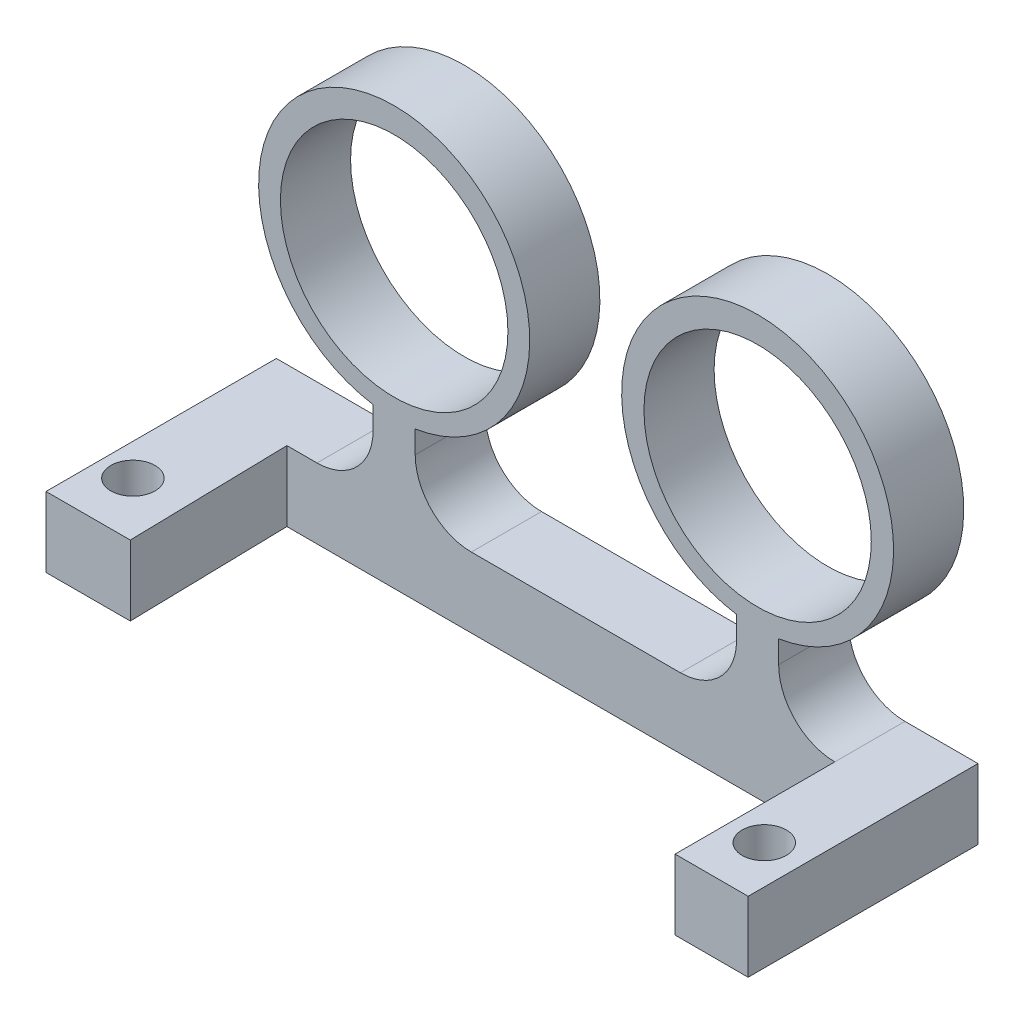
from build123d import *

# Parameters (mm, degrees)
SKETCH1_R           = 8.106403635
SKETCH1_R_2         = 8.1
BOSS_EXTRUDE2_DEPTH = 5
FILLET1_R           = 4
SKETCH3_W           = 5.205268412
SKETCH3_H           = 16.38085221
BOSS_EXTRUDE3_DEPTH = 5
SKETCH2_R           = 1.575419973
CUT_EXTRUDE1_DEPTH  = 5


with BuildPart() as part:
    # Sketch1 → Boss-Extrude2 (new body)
    with BuildSketch(Plane.XY):
        with BuildLine():
            Line((0, 0), (50, 0))
            Line((50, 0), (50, 5))
            Line((50, 5), (40.794731588, 5))
            Line((40.794731588, 5), (40.794731588, 10.6))
            ThreePointArc((40.794731588, 10.6), (39.294731588, 29.859964052), (37.794731588, 10.6))
            Line((37.794731588, 10.6), (37.794731588, 5))
            Line((37.794731588, 5), (14.894731588, 5))
            Line((14.894731588, 5), (14.894731588, 10.6))
            ThreePointArc((14.894731588, 10.6), (13.394731588, 29.802927968), (11.894731588, 10.6))
            Line((11.894731588, 10.6), (11.894731588, 5))
            Line((11.894731588, 5), (0, 5))
            Line((0, 5), (0, 0))
        make_face()
        with Locations((13.394731588, 19.909096331)):
            Circle(SKETCH1_R, mode=Mode.SUBTRACT)
        with Locations((39.294731588, 19.909096331)):
            Circle(SKETCH1_R_2, mode=Mode.SUBTRACT)
    extrude(amount=BOSS_EXTRUDE2_DEPTH)

    # Fillet1
    fillet1_edges = [part.edges().sort_by_distance(p)[0] for p in [
        (11.894731588, 5, 2.5),
        (14.894731588, 5, 2.5),
        (37.794731588, 5, 2.5),
        (40.794731588, 5, 2.5),
    ]]
    fillet(fillet1_edges, radius=FILLET1_R)

    # Sketch3 → Boss-Extrude3 (add)
    with BuildSketch(Plane(origin=(0, 5, 0), x_dir=(1, 0, 0), z_dir=(0, 1, 0))):
        Polygon((5.642760672, 0), (0, 0), (0, -16.416233716), (6.001314969, -16.410881412), align=None)
        with Locations((47.397365794, -8.190426105)):
            Rectangle(SKETCH3_W, SKETCH3_H)
    extrude(amount=-BOSS_EXTRUDE3_DEPTH)

    # Sketch2 → Cut-Extrude1 (cut)
    with BuildSketch(Plane(origin=(0, 5, 0), x_dir=(1, 0, 0), z_dir=(0, 1, 0))):
        with Locations(Location((2.276803949, -12.5, 0), (0, 0, 180))):
            Circle(SKETCH2_R)
        with Locations(Location((47.26704488, -12.5, 0), (0, 0, 180))):
            Circle(SKETCH2_R)
    extrude(amount=-CUT_EXTRUDE1_DEPTH, mode=Mode.SUBTRACT)


solid = part.part
